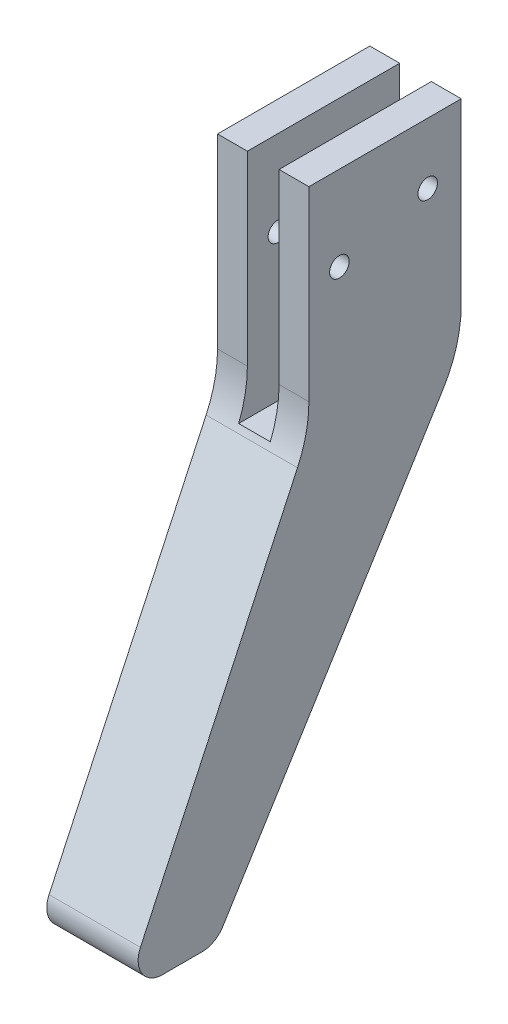
from build123d import *

# Parameters (mm, degrees)
BOSS_EXTRUDE1_DEPTH = 7.5
FILLET1_R           = 20
FILLET2_R           = 4
SKETCH2_W           = 5.2
SKETCH2_H           = 36.194595773
CUT_EXTRUDE1_DEPTH  = 38
CUT_EXTRUDE2_REACH  = 90.345
SKETCH3_R           = 1.6


with BuildPart() as part:
    # Sketch1 → Boss-Extrude1 (new, symmetric)
    with BuildSketch(Plane(origin=(0, 0, 0), x_dir=(0, 0, -1), z_dir=(1, 0, 0))):
        Polygon((-9.803921569, 21.588235294), (15.196078431, 21.588235294), (15.196078431, -13.411764706), (-25.113919349, -78.411764706), (-40.113919349, -78.411764706), (-9.803921569, -13.411764706), align=None)
    extrude(amount=BOSS_EXTRUDE1_DEPTH, both=True)

    # Fillet1
    fillet1_edges = [part.edges().sort_by_distance(p)[0] for p in [
        (0, -13.411764706, -15.196078431),
        (0, -13.411764706, 9.803921569),
    ]]
    fillet(fillet1_edges, radius=FILLET1_R)

    # Fillet2
    fillet2_edges = [part.edges().sort_by_distance(p)[0] for p in [
        (0, -78.411764706, 25.113919349),
        (0, -78.411764706, 40.113919349),
    ]]
    fillet(fillet2_edges, radius=FILLET2_R)

    # Sketch2 → Cut-Extrude1 (cut)
    with BuildSketch(Plane(origin=(0, 21.588235294, 0), x_dir=(1, 0, 0), z_dir=(0, 1, 0))):
        with Locations((0, 1.128729594)):
            Rectangle(SKETCH2_W, SKETCH2_H)
    extrude(amount=-CUT_EXTRUDE1_DEPTH, mode=Mode.SUBTRACT)

    # Cut-Extrude2: up to this face of the body (flat: up to its plane)
    cut_extrude2_end = Plane(part.part.faces().sort_by_distance((7.5, -23.945149467, 6.872044684))[0])
    # Sketch3 → Cut-Extrude2 (cut, up to the picked face)
    with BuildSketch(Plane.ZY.offset(7.5), mode=Mode.PRIVATE) as cut_extrude2_sk1:
        with Locations((-9.696078431, 11.588235294)):
            Circle(SKETCH3_R)
    cut_extrude2_tool1 = split(extrude(cut_extrude2_sk1.sketch, amount=-CUT_EXTRUDE2_REACH, mode=Mode.PRIVATE), bisect_by=cut_extrude2_end, keep=Keep.BOTH, mode=Mode.PRIVATE)
    # Sketch3 → Cut-Extrude2 (cut, up to the picked face)
    with BuildSketch(Plane.ZY.offset(7.5), mode=Mode.PRIVATE) as cut_extrude2_sk2:
        with Locations((4.803921569, 7.702972004)):
            Circle(SKETCH3_R)
    cut_extrude2_tool2 = split(extrude(cut_extrude2_sk2.sketch, amount=-CUT_EXTRUDE2_REACH, mode=Mode.PRIVATE), bisect_by=cut_extrude2_end, keep=Keep.BOTH, mode=Mode.PRIVATE)
    add(cut_extrude2_tool1.solids().sort_by(Axis((-7.5, 11.588235, -9.696078), (1, 0, 0)))[0], mode=Mode.SUBTRACT)
    add(cut_extrude2_tool2.solids().sort_by(Axis((-7.5, 7.702972, 4.803922), (1, 0, 0)))[0], mode=Mode.SUBTRACT)


solid = part.part
